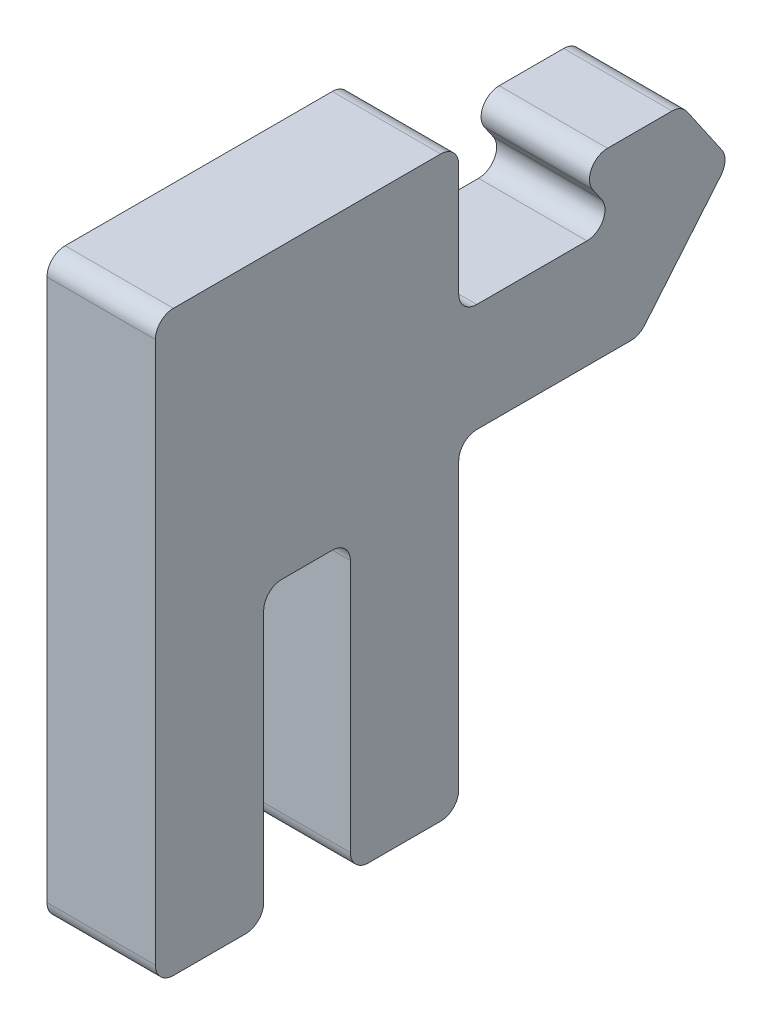
from build123d import *

# Parameters (mm, degrees)
CROQUIS1_W              = 8.4
CROQUIS1_H              = 16
SALIENTE_EXTRUIR1_DEPTH = 3
CROQUIS2_W              = 2.4
CROQUIS2_H              = 8
CORTAR_EXTRUIR1_DEPTH   = 3
SALIENTE_EXTRUIR2_DEPTH = 3
REDONDEO1_R             = 0.5


with BuildPart() as part:
    # Croquis1 → Saliente-Extruir1 (new body)
    with BuildSketch(Plane(origin=(0, 0, 0), x_dir=(0, 0, -1), z_dir=(1, 0, 0))):
        Rectangle(CROQUIS1_W, CROQUIS1_H)
    extrude(amount=SALIENTE_EXTRUIR1_DEPTH)

    # Croquis2 → Cortar-Extruir1 (cut)
    with BuildSketch(Plane(origin=(3, 0, 0), x_dir=(0, 0, -1), z_dir=(1, 0, 0))):
        with Locations((0, -4)):
            Rectangle(CROQUIS2_W, CROQUIS2_H)
    extrude(amount=-CORTAR_EXTRUIR1_DEPTH, mode=Mode.SUBTRACT)

    # Croquis4 → Saliente-Extruir2 (add)
    with BuildSketch(Plane(origin=(3, 0, 0), x_dir=(0, 0, -1), z_dir=(1, 0, 0))):
        Polygon((4.2, 3.891798286), (4.2, 0.891798286), (9.2, 0.891798286), (11.699701561, 3.892232325), (10.369105711, 5.827401467), (7.369105711, 5.827401467), (8.7, 3.891798286), align=None)
    extrude(amount=-SALIENTE_EXTRUIR2_DEPTH)

    # Redondeo1
    redondeo1_edges = [part.edges().sort_by_distance(p)[0] for p in [
        (1.5, -8, 1.2),
        (1.5, 0, 1.2),
        (1.5, 0, -1.2),
        (1.5, -8, -1.2),
        (1.5, 3.891798286, -4.2),
        (1.5, 3.891798286, -8.7),
        (1.5, 5.827401467, -7.369105711),
        (1.5, 5.827401467, -10.369105711),
        (1.5, 3.892232325, -11.699701561),
        (1.5, 0.891798286, -9.2),
        (1.5, 0.891798286, -4.2),
        (1.5, 8, 4.2),
        (1.5, 8, -4.2),
        (1.5, -8, -4.2),
        (1.5, -8, 4.2),
    ]]
    fillet(redondeo1_edges, radius=REDONDEO1_R)


solid = part.part
